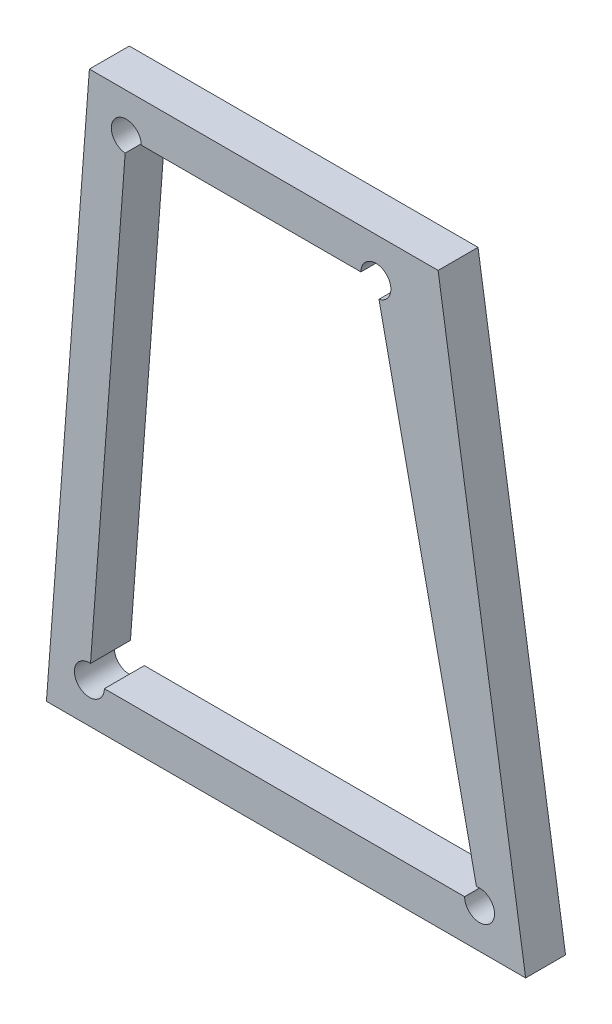
from build123d import *

# Parameters (mm, degrees)
EXTRUDE_1_DEPTH = 4


with BuildPart() as part:
    # Эскиз1 → Бобышка-Вытянуть1 (new body)
    with BuildSketch(Plane.XY):
        Polygon((0, 0), (48, 0), (39.231886792, 57), (4.301886792, 57), align=None)
        with BuildLine():
            Line((4.414773297, 5.495746181), (7.887113496, 51.504253819))
            ThreePointArc((7.887113496, 51.504253819), (6.980031804, 54.099847661), (9.5, 53))
            Line((9.5, 53), (31.5, 53))
            ThreePointArc((31.5, 53), (33.94432859, 54.165437048), (33.310991351, 51.532592633))
            Line((33.310991351, 51.532592633), (43.073702459, 5.467407367))
            ThreePointArc((43.073702459, 5.467407367), (44.550130858, 3.05567141), (41.88469381, 4))
            Line((41.88469381, 4), (5.801886792, 4))
            ThreePointArc((5.801886792, 4), (3.202039131, 2.980031804), (4.414773297, 5.495746181))
        make_face(mode=Mode.SUBTRACT)
    extrude(amount=EXTRUDE_1_DEPTH)


solid = part.part
